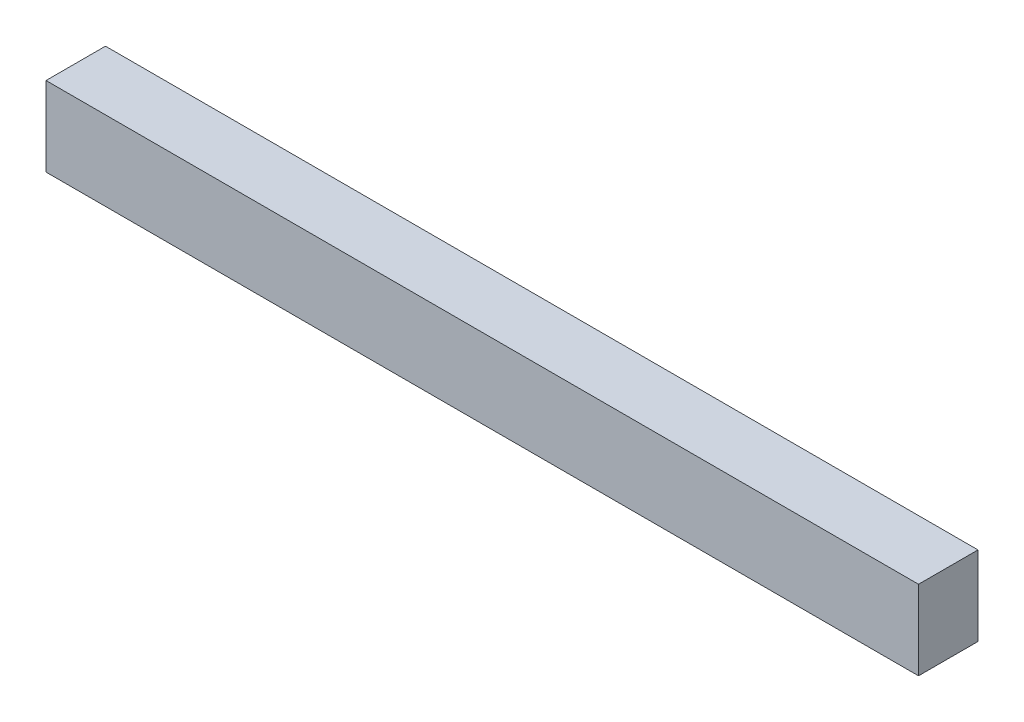
from build123d import *

# Parameters (mm, degrees)
ESQUISSE1_W        = 440
ESQUISSE1_H        = 40
BOSS_EXTRU_1_DEPTH = 30


with BuildPart() as part:
    # Esquisse1 → Boss.-Extru.1 (new body)
    with BuildSketch(Plane.XY):
        with Locations((220, 20)):
            Rectangle(ESQUISSE1_W, ESQUISSE1_H)
    extrude(amount=BOSS_EXTRU_1_DEPTH)


solid = part.part
